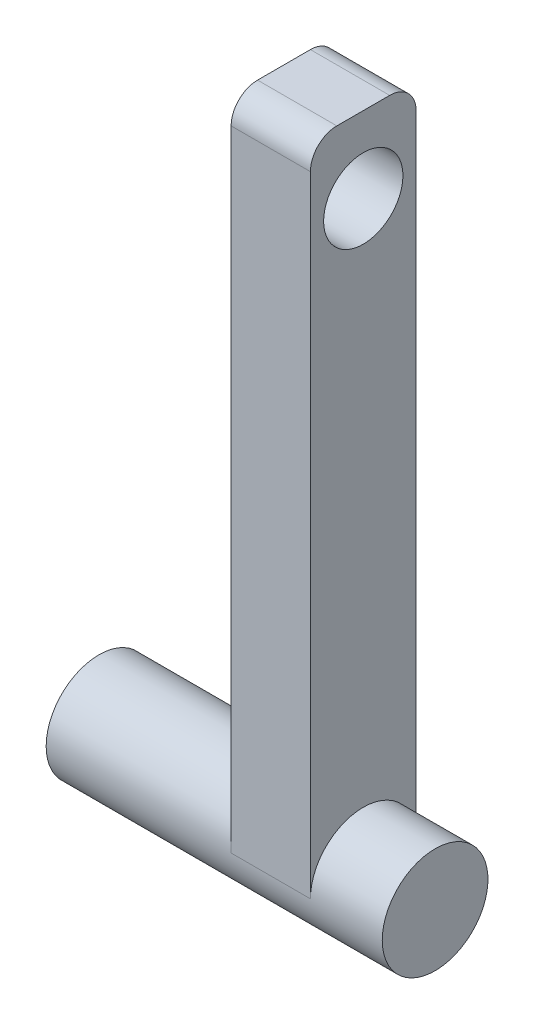
from build123d import *
from build123d.topology import SkipClean

# Parameters (mm, degrees)
SKETCH1_R           = 2
BOSS_EXTRUDE1_DEPTH = 42
BOSS_EXTRUDE2_DEPTH = 10
CUT_EXTRUDE1_DEPTH  = 7
BOSS_EXTRUDE4_DEPTH = 3
SKETCH5_R           = 1.5
CUT_EXTRUDE3_DEPTH  = 54.708670792
SKETCH6_W           = 11.822480184
SKETCH6_H           = 12.15707868
CUT_EXTRUDE5_DEPTH  = 54.708670792
FILLET4_R           = 1
FILLET5_R           = 1
SKETCH7_W           = 34.513514199
SKETCH7_H           = 14.72292105
CUT_EXTRUDE6_DEPTH  = 50.84257119
SKETCH8_W           = 4
SKETCH8_H           = 12.808527321
SKETCH8_R           = 1.5
BOSS_EXTRUDE5_DEPTH = 3
FILLET6_R           = 1


with BuildPart() as part:
    # Sketch1 → Boss-Extrude1 (new body)
    with BuildSketch(Plane(origin=(0, 0, 0), x_dir=(0, 0, -1), z_dir=(1, 0, 0))):
        with Locations(Location((-12.6584653, 7.000514901, 0), (0, 0, 180))):
            Circle(SKETCH1_R)
    extrude(amount=BOSS_EXTRUDE1_DEPTH)

    # Sketch2 → Boss-Extrude2 (add)
    with BuildSketch(Plane.ZY):
        with BuildLine():
            Line((10.6584653, 7.000514901), (10.6584653, 13.760469307))
            ThreePointArc((10.6584653, 13.760469307), (12.6584653, 15.760469307), (14.6584653, 13.760469307))
            Line((14.6584653, 13.760469307), (14.6584653, 7.000514901))
            ThreePointArc((14.6584653, 7.000514901), (12.6584653, 5.000514901), (10.6584653, 7.000514901))
        make_face()
    extrude(amount=-BOSS_EXTRUDE2_DEPTH)

    # Sketch3 → Cut-Extrude1 (cut)
    with SkipClean():  # the faces are left unmerged after this step: merging them gives an invalid solid
        with BuildSketch(Plane.ZY):
            with BuildLine():
                Line((10.6584653, 7.000514901), (10.6584653, 13.760469307))
                ThreePointArc((10.6584653, 13.760469307), (12.6584653, 15.760469307), (14.6584653, 13.760469307))
                Line((14.6584653, 13.760469307), (14.6584653, 7.000514901))
                ThreePointArc((14.6584653, 7.000514901), (12.6584653, 9.000514901), (10.6584653, 7.000514901))
            make_face()
        extrude(amount=-CUT_EXTRUDE1_DEPTH, mode=Mode.SUBTRACT)

    # Sketch4 → Boss-Extrude4 (add)
    with SkipClean():  # the faces are left unmerged after this step: merging them gives an invalid solid
        with BuildSketch(Plane.ZY.offset(-7)):
            with BuildLine():
                Line((10.6584653, 36.009876522), (10.6584653, 13.760469307))
                ThreePointArc((10.6584653, 13.760469307), (12.6584653, 15.760469307), (14.6584653, 13.760469307))
                Line((14.6584653, 13.760469307), (14.6584653, 36.009876522))
                Line((14.6584653, 36.009876522), (10.6584653, 36.009876522))
            make_face()
            with BuildLine():
                ThreePointArc((10.6584653, 36.009876522), (12.6584653, 38.009876522), (14.6584653, 36.009876522))
                Line((14.6584653, 36.009876522), (10.6584653, 36.009876522))
            make_face()
        extrude(amount=-BOSS_EXTRUDE4_DEPTH)

    # Sketch5 → Cut-Extrude3 (cut, through all)
    with SkipClean():  # the faces are left unmerged after this step: merging them gives an invalid solid
        with BuildSketch(Plane.ZY.offset(-7)):
            with Locations((12.706639089, 22.91954594)):
                Circle(SKETCH5_R)
        extrude(amount=-CUT_EXTRUDE3_DEPTH, mode=Mode.SUBTRACT)

    # Sketch6 → Cut-Extrude5 (cut, through all)
    with SkipClean():  # the faces are left unmerged after this step: merging them gives an invalid solid
        with BuildSketch(Plane.ZY.offset(-7)):
            with Locations((12.630555797, 32.616849438)):
                Rectangle(SKETCH6_W, SKETCH6_H)
        extrude(amount=-CUT_EXTRUDE5_DEPTH, mode=Mode.SUBTRACT)

    # Fillet4
    fillet4_edges = [part.edges().sort_by_distance(p)[0] for p in [
        (8.5, 26.538310098, 14.6584653),
    ]]
    fillet(fillet4_edges, radius=FILLET4_R)

    # Fillet5
    fillet5_edges = [part.edges().sort_by_distance(p)[0] for p in [
        (8.5, 26.538310098, 10.6584653),
    ]]
    fillet(fillet5_edges, radius=FILLET5_R)

    # Sketch7 → Cut-Extrude6 (cut, through all)
    with BuildSketch(Plane(origin=(0, 0, 10.6584653), x_dir=(-1, 0, 0), z_dir=(0, 0, -1))):
        with Locations((-29.975495684, 6.364049631)):
            Rectangle(SKETCH7_W, SKETCH7_H)
    extrude(amount=-CUT_EXTRUDE6_DEPTH, mode=Mode.SUBTRACT)

    # Sketch8 → Boss-Extrude5 (add)
    with SkipClean():  # the faces are left unmerged after this step: merging them gives an invalid solid
        with BuildSketch(Plane.ZY.offset(-7)):
            with Locations((12.6584653, 25.427627083)):
                Rectangle(SKETCH8_W, SKETCH8_H)
            with Locations((12.6584653, 28.953962247)):
                Circle(SKETCH8_R, mode=Mode.SUBTRACT)
        extrude(amount=-BOSS_EXTRUDE5_DEPTH)

    # Fillet6
    fillet6_edges = [part.edges().sort_by_distance(p)[0] for p in [
        (8.5, 31.831890743, 14.6584653),
        (8.5, 31.831890743, 10.6584653),
    ]]
    fillet(fillet6_edges, radius=FILLET6_R)


solid = part.part
